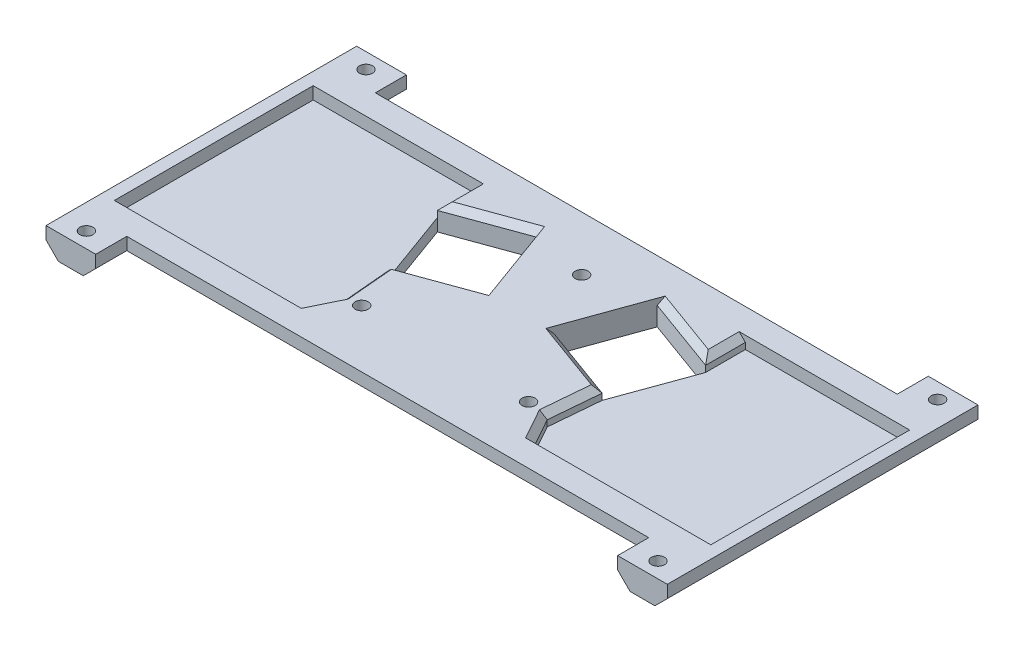
from build123d import *

# Parameters (mm, degrees)
SKETCH_1_W      = 200
SKETCH_1_H      = 80
SKETCH_1_R      = 2.1
EXTRUDE_1_DEPTH = 4
SKETCH_2_W      = 200
SKETCH_2_H      = 80
SKETCH_2_W_2    = 192
SKETCH_2_H_2    = 64
SKETCH_2_R      = 6
SKETCH_2_R_2    = 2.1
EXTRUDE_4_DEPTH = 4
SKETCH_4_W      = 16
SKETCH_4_H      = 10
SKETCH_4_R      = 2.1
EXTRUDE_5_DEPTH = 8
CHAMFER_2_SIZE  = 4
CHAMFER_3_SIZE  = 2


with BuildPart() as part:
    # Эскиз1 → Бобышка-Вытянуть1 (new body)
    with BuildSketch(Plane(origin=(0, 0, 0), x_dir=(1, 0, 0), z_dir=(0, 1, 0))):
        with Locations((9.289774647, 44.419345598)):
            Rectangle(SKETCH_1_W, SKETCH_1_H)
        with Locations(Location((9.238204765, 66.885667768, 0), (0, 0, 270))):
            Circle(SKETCH_1_R, mode=Mode.SUBTRACT)
        with Locations(Location((36.096151087, 22.941432753, 0), (0, 0, 270))):
            Circle(SKETCH_1_R, mode=Mode.SUBTRACT)
        with Locations(Location((-17.619741555, 22.941432753, 0), (0, 0, 270))):
            Circle(SKETCH_1_R, mode=Mode.SUBTRACT)
        Polygon((19.089140112, 48.079252727), (27.915271652, 72.535858158), (52.411725454, 63.619878129), (43.532640104, 39.193825212), align=None, mode=Mode.SUBTRACT)
        Polygon((-33.936103706, 63.620851303), (-25.043175056, 39.187730639), (-0.611166915, 48.080254364), (-9.504095565, 72.513375028), align=None, mode=Mode.SUBTRACT)
    extrude(amount=EXTRUDE_1_DEPTH)

    # Эскиз2 → Бобышка-Вытянуть4 (add)
    # profile 1 of 5: a face of its own
    with BuildSketch(Plane(origin=(0, 4, 0), x_dir=(1, 0, 0), z_dir=(0, 1, 0))):
        with Locations((9.289774647, 44.419345598)):
            Rectangle(SKETCH_2_W, SKETCH_2_H)
        with Locations((9.289774647, 44.419345598)):
            Rectangle(SKETCH_2_W_2, SKETCH_2_H_2, mode=Mode.SUBTRACT)
    # profile 2 of 5: a face of its own
    with BuildSketch(Plane(origin=(0, 4, 0), x_dir=(1, 0, 0), z_dir=(0, 1, 0))):
        with Locations((-17.619741555, 22.941432753)):
            Circle(SKETCH_2_R)
        with Locations(Location((-17.619741555, 22.941432753, 0), (0, 0, 180))):
            Circle(SKETCH_2_R_2, mode=Mode.SUBTRACT)
    # profile 3 of 5: a face of its own
    with BuildSketch(Plane(origin=(0, 4, 0), x_dir=(1, 0, 0), z_dir=(0, 1, 0))):
        with Locations((36.096151087, 22.941432753)):
            Circle(SKETCH_2_R)
        with Locations(Location((36.096151087, 22.941432753, 0), (0, 0, 180))):
            Circle(SKETCH_2_R_2, mode=Mode.SUBTRACT)
    # profile 4 of 5: a face of its own
    with BuildSketch(Plane(origin=(0, 4, 0), x_dir=(1, 0, 0), z_dir=(0, 1, 0))):
        with BuildLine():
            Line((-23.619741555, 22.941432753), (-28.77792263, 12.419345598))
            Line((-28.77792263, 12.419345598), (47.972182779, 12.419345598))
            Line((47.972182779, 12.419345598), (42.096151087, 22.941432753))
            ThreePointArc((42.096151087, 22.941432753), (36.096151087, 16.941432753), (30.096151087, 22.941432753))
            Line((30.096151087, 22.941432753), (-11.619741555, 22.941432753))
            ThreePointArc((-11.619741555, 22.941432753), (-17.619741555, 16.941432753), (-23.619741555, 22.941432753))
        make_face()
    # profile 5 of 5: a face of its own
    with BuildSketch(Plane(origin=(0, 4, 0), x_dir=(1, 0, 0), z_dir=(0, 1, 0))):
        with BuildLine():
            Line((-25.043175056, 39.187730639), (-23.619741555, 22.941432753))
            ThreePointArc((-23.619741555, 22.941432753), (-17.619741555, 28.941432753), (-11.619741555, 22.941432753))
            Line((-11.619741555, 22.941432753), (30.096151087, 22.941432753))
            ThreePointArc((30.096151087, 22.941432753), (36.096151087, 28.941432753), (42.096151087, 22.941432753))
            Line((42.096151087, 22.941432753), (43.532640104, 39.193825212))
            Line((43.532640104, 39.193825212), (19.089140112, 48.079252727))
            Line((19.089140112, 48.079252727), (27.915271652, 72.535858158))
            Line((27.915271652, 72.535858158), (52.411725454, 63.619878129))
            Line((52.411725454, 63.619878129), (52.411725454, 76.419345598))
            Line((52.411725454, 76.419345598), (-33.936103706, 76.419345598))
            Line((-33.936103706, 76.419345598), (-33.936103706, 63.620851303))
            Line((-33.936103706, 63.620851303), (-9.504095565, 72.513375028))
            Line((-9.504095565, 72.513375028), (-0.611166915, 48.080254364))
            Line((-0.611166915, 48.080254364), (-25.043175056, 39.187730639))
        make_face()
        with Locations(Location((9.238204765, 66.885667768, 0), (0, 0, 180))):
            Circle(SKETCH_2_R_2, mode=Mode.SUBTRACT)
    extrude(amount=EXTRUDE_4_DEPTH)

    # Эскиз4 → Бобышка-Вытянуть5 (add)
    # profile 1 of 4: a face of its own
    with BuildSketch(Plane(origin=(0, 8, 0), x_dir=(1, 0, 0), z_dir=(0, 1, 0))):
        with Locations((101.289774647, 89.419345598)):
            Rectangle(SKETCH_4_W, SKETCH_4_H)
        with Locations(Location((101.289774647, 89.419345598, 0), (0, 0, 180))):
            Circle(SKETCH_4_R, mode=Mode.SUBTRACT)
    # profile 2 of 4: a face of its own
    with BuildSketch(Plane(origin=(0, 8, 0), x_dir=(1, 0, 0), z_dir=(0, 1, 0))):
        with Locations((-82.710225353, 89.419345598)):
            Rectangle(SKETCH_4_W, SKETCH_4_H)
        with Locations(Location((-82.710225353, 89.419345598, 0), (0, 0, 180))):
            Circle(SKETCH_4_R, mode=Mode.SUBTRACT)
    # profile 3 of 4: a face of its own
    with BuildSketch(Plane(origin=(0, 8, 0), x_dir=(1, 0, 0), z_dir=(0, 1, 0))):
        with Locations((101.289774647, -0.580654402)):
            Rectangle(SKETCH_4_W, SKETCH_4_H)
        with Locations(Location((101.289774647, -0.580654402, 0), (0, 0, 180))):
            Circle(SKETCH_4_R, mode=Mode.SUBTRACT)
    # profile 4 of 4: a face of its own
    with BuildSketch(Plane(origin=(0, 8, 0), x_dir=(1, 0, 0), z_dir=(0, 1, 0))):
        with Locations((-82.710225353, -0.580654402)):
            Rectangle(SKETCH_4_W, SKETCH_4_H)
        with Locations(Location((-82.710225353, -0.580654402, 0), (0, 0, 180))):
            Circle(SKETCH_4_R, mode=Mode.SUBTRACT)
    extrude(amount=-EXTRUDE_5_DEPTH)

    # Фаска2
    chamfer_2_edges = [part.edges().sort_by_distance(p)[0] for p in [
        (9.289774647, 0, -84.419345598),
        (93.289774647, 0, -89.419345598),
        (93.289774647, 0, 0.580654402),
        (-74.710225353, 0, -89.419345598),
        (9.289774647, 0, -4.419345598),
        (-74.710225353, 0, 0.580654402),
        (-90.710225353, 0, -44.419345598),
        (109.289774647, 0, -44.419345598),
    ]]
    chamfer(chamfer_2_edges, length=CHAMFER_2_SIZE)

    # Фаска3
    chamfer_3_edges = [part.edges().sort_by_distance(p)[0] for p in [
        (-33.936103706, 8, -70.020098451),
        (-12.827170986, 8, -43.633992502),
        (45.034166933, 8, -17.680389175),
        (-24.331458306, 8, -31.064581696),
        (42.814395596, 8, -31.067628982),
        (31.310890108, 8, -43.63653897),
        (40.163498553, 8, -68.077868143),
        (52.411725454, 8, -70.019611864),
        (-26.198832093, 8, -17.680389175),
        (-21.720099636, 8, -68.067113165),
    ]]
    chamfer(chamfer_3_edges, length=CHAMFER_3_SIZE)


solid = part.part
